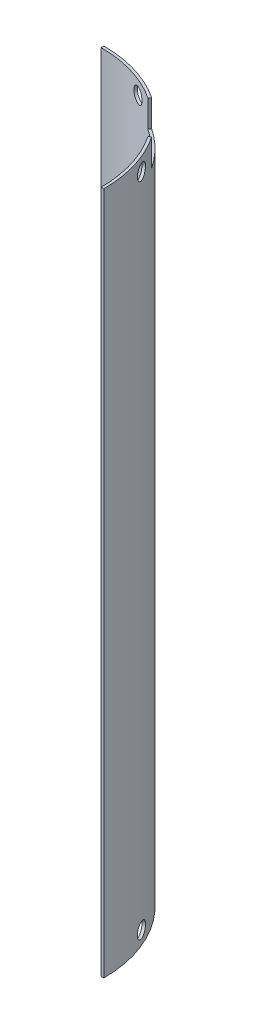
from build123d import *

# Parameters (mm, degrees)
BOSS_EXTRUDE1_DEPTH     = 508.5
CUT_EXTRUDE4_REACH      = 518.756
CUT_EXTRUDE4_END_RADIUS = 90
SKETCH6_R               = 5.565
CUT_EXTRUDE2_REACH      = 520.673
CUT_EXTRUDE2_END_RADIUS = 90
SKETCH3_R               = 5.565
CUT_EXTRUDE3_REACH      = 520.673
CUT_EXTRUDE3_END_RADIUS = 90
SKETCH5_R               = 5.565
LPATTERN2_COUNT         = 2
LPATTERN2_PITCH         = 488.5
CUT_EXTRUDE5_DEPTH      = 20
BODY_MOVE_COPY1_ANGLE   = 180


with BuildPart() as part:
    # Sketch1 → Boss-Extrude1 (new body)
    with BuildSketch(Plane(origin=(0, 0, 0), x_dir=(1, 0, 0), z_dir=(0, 1, 0))):
        with BuildLine():
            Line((0, 92), (0, 90))
            ThreePointArc((0, 90), (63.639610307, 63.639610307), (90, 0))
            Line((90, 0), (92, 0))
            ThreePointArc((92, 0), (65.053823869, 65.053823869), (0, 92))
        make_face()
    extrude(amount=BOSS_EXTRUDE1_DEPTH)

    # Cut-Extrude4: up to this cylinder (the profile starts outside it)
    cut_extrude4_end = Plane(origin=(0, 10, 0), z_dir=(0, -1, 0)) * Cylinder(CUT_EXTRUDE4_END_RADIUS, 1218.512, mode=Mode.PRIVATE)
    # Sketch6 → Cut-Extrude4 (cut, up to the surface)
    with BuildSketch(Plane(origin=(65.053823869, 0, -65.053823869), x_dir=(-0.7071067811865486, 0, -0.7071067811865465), z_dir=(0.7071067811865465, 0, -0.7071067811865486)), mode=Mode.PRIVATE) as cut_extrude4_sk1:
        with Locations((0, 10)):
            Circle(SKETCH6_R)
    cut_extrude4_tool1 = extrude(cut_extrude4_sk1.sketch, amount=-CUT_EXTRUDE4_REACH, mode=Mode.PRIVATE) - cut_extrude4_end
    add(cut_extrude4_tool1.solids().sort_by_distance((65.053824, 10, -65.053824))[0], mode=Mode.SUBTRACT)

    # Cut-Extrude2: up to this cylinder (the profile starts outside it)
    cut_extrude2_end = Plane(origin=(0, 10, 0), z_dir=(0, -1, 0)) * Cylinder(CUT_EXTRUDE2_END_RADIUS, 1222.346, mode=Mode.PRIVATE)
    # Sketch3 → Cut-Extrude2 (cut, up to the surface)
    with BuildSketch(Plane(origin=(84.996916991, 0, -35.206875778), x_dir=(-0.38268343236509045, 0, -0.9238795325112865), z_dir=(0.9238795325112865, 0, -0.38268343236509045)), mode=Mode.PRIVATE) as cut_extrude2_sk1:
        with Locations((0, 10)):
            Circle(SKETCH3_R)
    cut_extrude2_tool1 = extrude(cut_extrude2_sk1.sketch, amount=-CUT_EXTRUDE2_REACH, mode=Mode.PRIVATE) - cut_extrude2_end
    cut_extrude2 = cut_extrude2_tool1.solids().sort_by_distance((84.996917, 10, -35.206876))[0]
    add(cut_extrude2, mode=Mode.SUBTRACT)

    # Cut-Extrude3: up to this cylinder (the profile starts outside it)
    cut_extrude3_end = Plane(origin=(0, 10, 0), z_dir=(0, -1, 0)) * Cylinder(CUT_EXTRUDE3_END_RADIUS, 1222.346, mode=Mode.PRIVATE)
    # Sketch5 → Cut-Extrude3 (cut, up to the surface)
    with BuildSketch(Plane(origin=(35.206875778, 0, -84.996916991), x_dir=(-0.9238795325112878, 0, -0.3826834323650876), z_dir=(0.3826834323650876, 0, -0.9238795325112878)), mode=Mode.PRIVATE) as cut_extrude3_sk1:
        with Locations((0, 10)):
            Circle(SKETCH5_R)
    cut_extrude3_tool1 = extrude(cut_extrude3_sk1.sketch, amount=-CUT_EXTRUDE3_REACH, mode=Mode.PRIVATE) - cut_extrude3_end
    cut_extrude3 = cut_extrude3_tool1.solids().sort_by_distance((35.206876, 10, -84.996917))[0]
    add(cut_extrude3, mode=Mode.SUBTRACT)

    # LPattern2: Cut-Extrude2, Cut-Extrude3 ×2
    with Locations(*[(0, i * LPATTERN2_PITCH, 0) for i in range(1, LPATTERN2_COUNT)]):
        add(cut_extrude2, mode=Mode.SUBTRACT)
        add(cut_extrude3, mode=Mode.SUBTRACT)

    # Sketch7 → Cut-Extrude5 (cut)
    with BuildSketch(Plane.XZ):
        with BuildLine():
            Line((76.447375943, -51.183969281), (74.784435976, -50.072828318))
            ThreePointArc((74.784435976, -50.072828318), (63.639610307, -63.639610307), (50.072828318, -74.784435976))
            Line((50.072828318, -74.784435976), (51.183969281, -76.447375943))
            ThreePointArc((51.183969281, -76.447375943), (65.053823869, -65.053823869), (76.447375943, -51.183969281))
        make_face()
    extrude(amount=-CUT_EXTRUDE5_DEPTH, mode=Mode.SUBTRACT)


with BuildPart() as part_1:
    # Body-Move/Copy1: moved
    add(part.part.moved(Location((0, 0, 0))).rotate(Axis((0, 252, 0), (0.7071067811865488, -4.937700262164522e-15, -0.7071067811865462)), BODY_MOVE_COPY1_ANGLE))


solid = part_1.part
